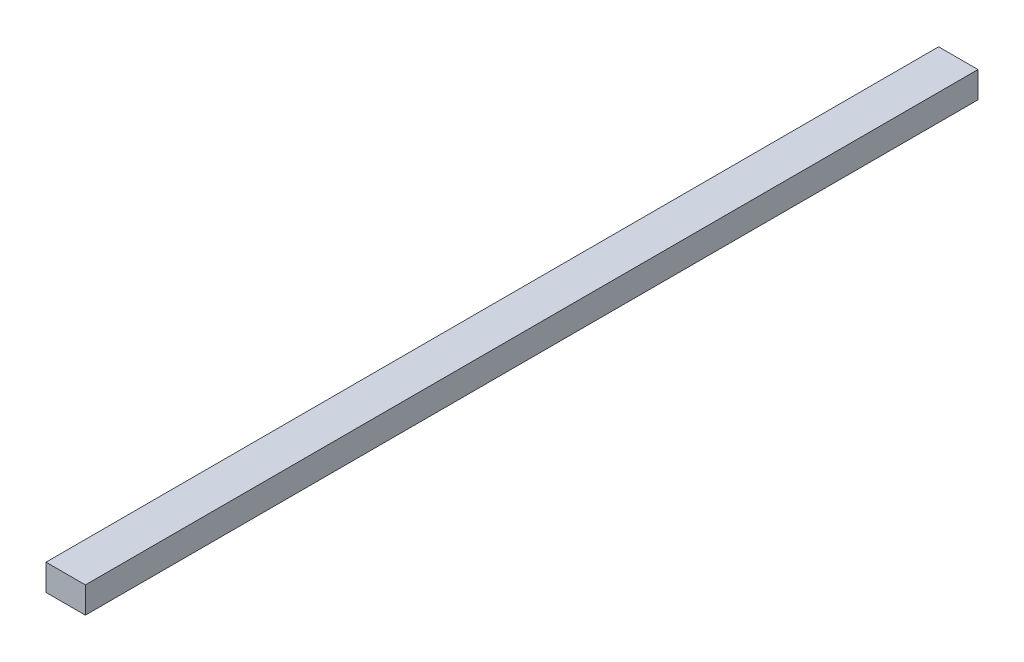
from build123d import *

# Parameters (mm, degrees)
KAP_KIZAK_SAG_30X20_1_START = -20
SKETCH1_W                   = 30
SKETCH1_H                   = 20
KAP_KIZAK_SAG_30X20_1_DEPTH = 680


with BuildPart() as part:
    # Sketch1 → KAP_kizak_sag_30x20_1 (new body)
    with BuildSketch(Plane.XY.offset(KAP_KIZAK_SAG_30X20_1_START)):
        with Locations((50, 10)):
            Rectangle(SKETCH1_W, SKETCH1_H)
    extrude(amount=-KAP_KIZAK_SAG_30X20_1_DEPTH)


solid = part.part
